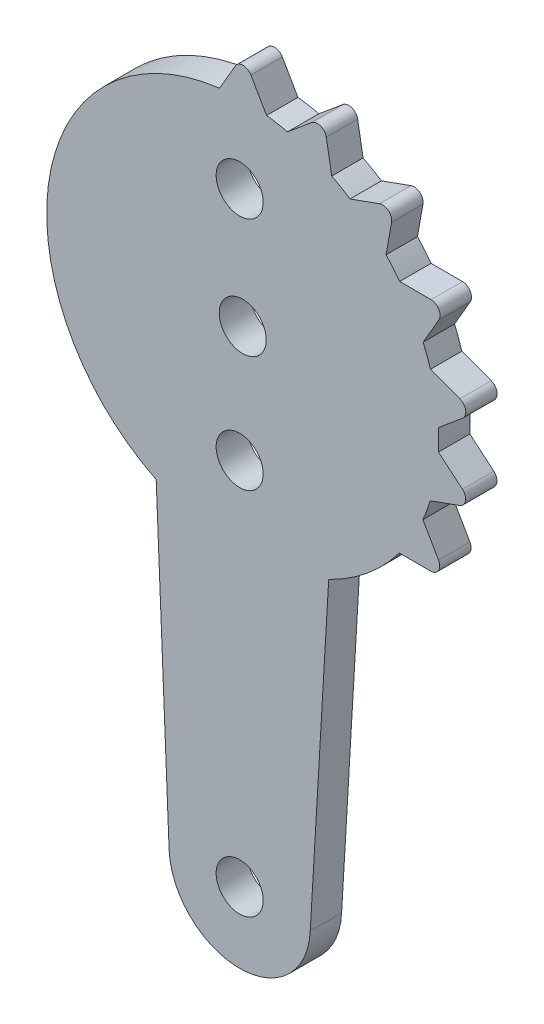
from build123d import *

# Parameters (mm, degrees)
SKETCH1_R           = 1.5
BOSS_EXTRUDE1_DEPTH = 2


with BuildPart() as part:
    # Sketch1 → Boss-Extrude1 (new body)
    with BuildSketch(Plane.XY):
        with BuildLine():
            Line((-5.322767432, 19.832757644), (-4.500006862, -0.184957582))
            ThreePointArc((-4.500006862, -0.184957582), (-0.000167017, -4.503806283), (4.499993132, -0.185291335))
            Line((4.499993132, -0.185291335), (5.67721776, 19.814708665))
            ThreePointArc((5.67721776, 19.814708665), (8.148561948, 21.404983206), (10.180318916, 23.528301089))
            Line((10.180318916, 23.528301089), (12.180312779, 23.523346368))
            ThreePointArc((12.180312779, 23.523346368), (12.679597114, 23.812434692), (12.680312779, 24.389371772))
            Line((12.680312779, 24.389371772), (11.684612917, 26.123898158))
            ThreePointArc((11.684612917, 26.123898158), (11.934719035, 26.754030681), (12.150293859, 27.396796239))
            Line((12.150293859, 27.396796239), (14.031367948, 28.076178512))
            ThreePointArc((14.031367948, 28.076178512), (14.401667723, 28.518597977), (14.205016126, 29.060986265))
            Line((14.205016126, 29.060986265), (12.67612135, 30.350358501))
            ThreePointArc((12.67612135, 30.350358501), (12.695626208, 31.028030714), (12.678361511, 31.705763698))
            Line((12.678361511, 31.705763698), (14.213630529, 32.987539436))
            ThreePointArc((14.213630529, 32.987539436), (14.410282126, 33.529927724), (14.039982351, 33.972347189))
            Line((14.039982351, 33.972347189), (12.162299935, 34.661047954))
            ThreePointArc((12.162299935, 34.661047954), (11.948850959, 35.304522586), (11.700829119, 35.935478396))
            Line((11.700829119, 35.935478396), (12.705116964, 37.665046528))
            ThreePointArc((12.705116964, 37.665046528), (12.704401299, 38.241983607), (12.205116964, 38.531071932))
            Line((12.205116964, 38.531071932), (10.205123119, 38.536033749))
            ThreePointArc((10.205123119, 38.536033749), (9.784465406, 39.067698263), (9.335601516, 39.575774317))
            Line((9.335601516, 39.575774317), (9.687776253, 41.5445234))
            ThreePointArc((9.687776253, 41.5445234), (9.489779645, 42.086422145), (8.92173181, 42.18731101))
            Line((8.92173181, 42.18731101), (7.040655311, 41.507935412))
            ThreePointArc((7.040655311, 41.507935412), (6.463526388, 41.863663221), (5.867960059, 42.187578047))
            Line((5.867960059, 42.187578047), (5.525544216, 44.158047887))
            ThreePointArc((5.525544216, 44.158047887), (5.154147979, 44.59954731), (4.585851596, 44.500068031))
            Line((4.585851596, 44.500068031), (3.050578029, 43.21829774))
            ThreePointArc((3.050578029, 43.21829774), (2.386588163, 43.355182821), (1.716153483, 43.455867511))
            Line((1.716153483, 43.455867511), (0.720447466, 45.190390364))
            ThreePointArc((0.720447466, 45.190390364), (0.220447466, 45.47823912), (-0.279552534, 45.190390364))
            Line((-0.279552534, 45.190390364), (-1.283846517, 43.460825796))
            ThreePointArc((-1.283846517, 43.460825796), (-12.125641313, 33.154858755), (-5.322767432, 19.832757644))
        make_face()
        with Locations((0.19564328, 31.048690205)):
            Circle(SKETCH1_R, mode=Mode.SUBTRACT)
        with Locations((0, 38.546138017)):
            Circle(SKETCH1_R, mode=Mode.SUBTRACT)
        with Locations((0, 23.551242392)):
            Circle(SKETCH1_R, mode=Mode.SUBTRACT)
        Circle(SKETCH1_R, mode=Mode.SUBTRACT)
    extrude(amount=BOSS_EXTRUDE1_DEPTH)


solid = part.part
